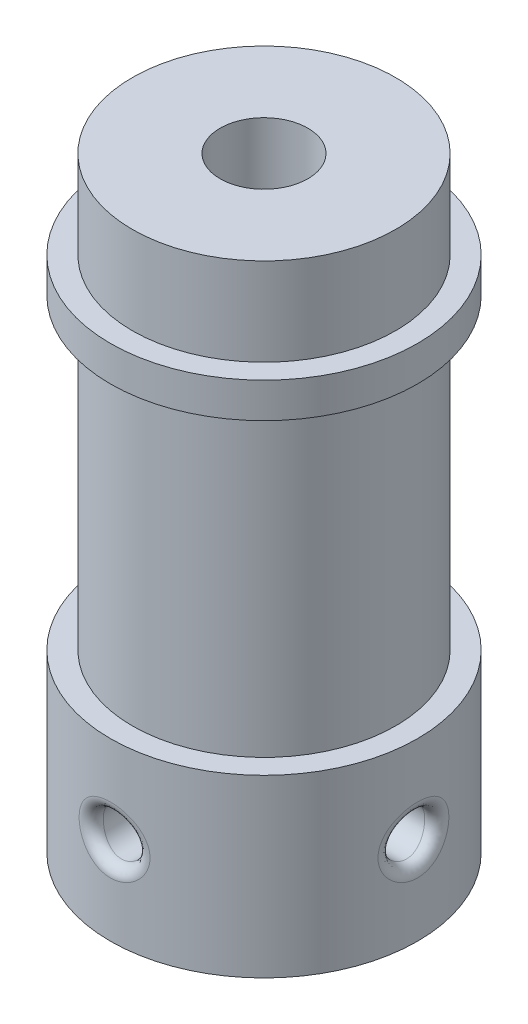
from build123d import *

# Parameters (mm, degrees)
SKETCH1_R               = 7
BOSS_EXTRUDE1_DEPTH     = 8
SKETCH2_R               = 6
BOSS_EXTRUDE2_DEPTH     = 14
SKETCH3_R               = 7
BOSS_EXTRUDE3_DEPTH     = 1.6
SKETCH4_R               = 6
BOSS_EXTRUDE4_DEPTH     = 4
SKETCH5_R               = 2
CUT_EXTRUDE1_DEPTH      = 30.321664346
SKETCH6_R               = 3
CUT_EXTRUDE2_DEPTH      = 20
CUT_EXTRUDE3_REACH      = 33.729
CUT_EXTRUDE3_END_RADIUS = 3
SKETCH8_R               = 1
CIRPATTERN1_COUNT       = 2
CIRPATTERN1_ANGLE       = 90
FILLET1_R               = 0.5


with BuildPart() as part:
    # Sketch1 → Boss-Extrude1 (new body)
    with BuildSketch(Plane(origin=(0, 0, 0), x_dir=(1, 0, 0), z_dir=(0, 1, 0))):
        with Locations(Location((0, 0, 0), (0, 0, 270))):
            Circle(SKETCH1_R)
    extrude(amount=BOSS_EXTRUDE1_DEPTH)

    # Sketch2 → Boss-Extrude2 (add)
    with BuildSketch(Plane(origin=(0, 8, 0), x_dir=(1, 0, 0), z_dir=(0, 1, 0))):
        with Locations(Location((0, 0, 0), (0, 0, 270))):
            Circle(SKETCH2_R)
    extrude(amount=BOSS_EXTRUDE2_DEPTH)

    # Sketch3 → Boss-Extrude3 (add)
    with BuildSketch(Plane(origin=(0, 22, 0), x_dir=(1, 0, 0), z_dir=(0, 1, 0))):
        with Locations(Location((0, 0, 0), (0, 0, 270))):
            Circle(SKETCH3_R)
    extrude(amount=BOSS_EXTRUDE3_DEPTH)

    # Sketch4 → Boss-Extrude4 (add)
    with BuildSketch(Plane(origin=(0, 23.6, 0), x_dir=(1, 0, 0), z_dir=(0, 1, 0))):
        with Locations(Location((0, 0, 0), (0, 0, 270))):
            Circle(SKETCH4_R)
    extrude(amount=BOSS_EXTRUDE4_DEPTH)

    # Sketch5 → Cut-Extrude1 (cut, through all)
    with BuildSketch(Plane(origin=(0, 27.6, 0), x_dir=(1, 0, 0), z_dir=(0, 1, 0))):
        with Locations(Location((0, 0, 0), (0, 0, 270))):
            Circle(SKETCH5_R)
    extrude(amount=-CUT_EXTRUDE1_DEPTH, mode=Mode.SUBTRACT)

    # Sketch6 → Cut-Extrude2 (cut)
    with BuildSketch(Plane.XZ):
        with Locations(Location((0, 0, 0), (0, 0, 270))):
            Circle(SKETCH6_R)
    extrude(amount=-CUT_EXTRUDE2_DEPTH, mode=Mode.SUBTRACT)

    # Cut-Extrude3: up to this cylinder (the profile starts outside it)
    cut_extrude3_end = Plane(origin=(0, 4, 0), z_dir=(0, -1, 0)) * Cylinder(CUT_EXTRUDE3_END_RADIUS, 74.458, mode=Mode.PRIVATE)
    # Sketch8 → Cut-Extrude3 (cut, up to the surface)
    with BuildSketch(Plane.XY.offset(7), mode=Mode.PRIVATE) as cut_extrude3_sk1:
        with Locations((0, 4)):
            Circle(SKETCH8_R)
    cut_extrude3_tool1 = extrude(cut_extrude3_sk1.sketch, amount=-CUT_EXTRUDE3_REACH, mode=Mode.PRIVATE) - cut_extrude3_end
    cut_extrude3 = cut_extrude3_tool1.solids().sort_by_distance((0, 4, 7))[0]
    add(cut_extrude3, mode=Mode.SUBTRACT)

    # CirPattern1: Cut-Extrude3 ×2 about axis
    cirpattern1_axis = Axis((0, 0, 0), (0, 1, 0))
    for i in range(1, CIRPATTERN1_COUNT):
        add(cut_extrude3.rotate(cirpattern1_axis, i * CIRPATTERN1_ANGLE / (CIRPATTERN1_COUNT - 1)), mode=Mode.SUBTRACT)

    # Fillet1
    fillet1_edges = [part.edges().sort_by_distance(p)[0] for p in [
        (-1, 4, 6.92820323),
        (6.92820323, 4, 1),
    ]]
    fillet(fillet1_edges, radius=FILLET1_R)


solid = part.part
